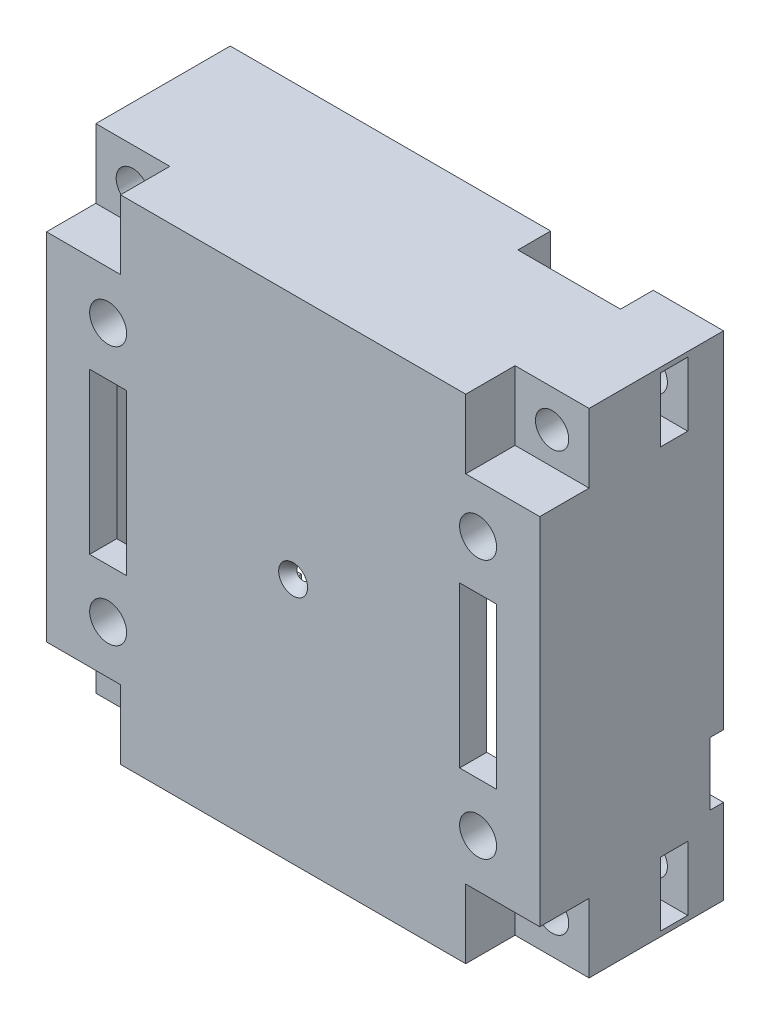
from build123d import *

# Parameters (mm, degrees)
SKETCH_1_W               = 40
SKETCH_1_H               = 40
EXTRUDE_1_DEPTH          = 12.7
CUT_EXTRUDE_2_DEPTH      = 0.7
CUT_EXTRUDE_2_DEPTH_BACK = 1.5
SKETCH_8_W               = 36.4
SKETCH_8_H               = 28.4
CUT_EXTRUDE_4_DEPTH      = 12.7
SKETCH_10_R              = 0.5
SKETCH_10_R_2            = 1.5
SKETCH_10_W              = 3
SKETCH_10_H              = 13
EXTRUDE_2_DEPTH          = 2.2
CUT_EXTRUDE_START        = -12.7
SKETCH_13_R              = 1.35
CUT_EXTRUDE_6_DEPTH      = 12.7
FILLET_1_R               = 1
SKETCH_14_W              = 8.31999735
SKETCH_14_H              = 2.64999918
CUT_EXTRUDE_8_DEPTH      = 5.8
SKETCH_15_W              = 12.8999835
SKETCH_15_H              = 7.3
CUT_EXTRUDE_9_DEPTH      = 5.8
SKETCH_16_W              = 1.085536683
SKETCH_16_H              = 5.100270408
CUT_EXTRUDE_10_DEPTH     = 1.8
SKETCH_17_W              = 8.31999735
SKETCH_17_H              = 2.65925193
CUT_EXTRUDE_11_DEPTH     = 5.8
SKETCH_23_W              = 6.0022214
SKETCH_23_H              = 5.598076211
SKETCH_23_H_2            = 5.598076212
CUT_EXTRUDE_12_DEPTH     = 4
SKETCH_24_W              = 11
SKETCH_24_H              = 14
CUT_EXTRUDE_14_DEPTH     = 1.4


with BuildPart() as part:
    # 草图1 → 凸台-拉伸1 (new body)
    with BuildSketch(Plane(origin=(0, 0, -12.4), x_dir=(-1, 0, 0), z_dir=(0, 0, -1))):
        with Locations((-18.22949197, 11.132690632)):
            Rectangle(SKETCH_1_W, SKETCH_1_H)
    extrude(amount=-EXTRUDE_1_DEPTH)

    # 草图2 → 切除-拉伸2 (cut, two sides: drawn at the far end of the back side and taken through both)
    with BuildSketch(Plane.XY.offset(-8).offset(-CUT_EXTRUDE_2_DEPTH_BACK)):
        Polygon((-2.01828663, -8.469233156), (2.73171337, -8.469233156), (4.23171337, -5.871156945), (2.72949197, -3.269233156), (-2.01828663, -3.269233156), align=None)
        Polygon((-2.01828663, 25.534614421), (-2.01828663, 30.734614421), (2.73171337, 30.734614421), (4.23171337, 28.13653821), (2.72949197, 25.534614421), align=None)
        Polygon((38.47727057, 30.734614421), (33.72727057, 30.734614421), (32.22727057, 28.13653821), (33.72949197, 25.534614421), (38.47727057, 25.534614421), align=None)
        Polygon((38.47727057, -3.269233156), (38.47727057, -8.469233156), (33.72727057, -8.469233156), (32.22727057, -5.871156945), (33.72949197, -3.269233156), align=None)
    extrude(amount=CUT_EXTRUDE_2_DEPTH + CUT_EXTRUDE_2_DEPTH_BACK, mode=Mode.SUBTRACT)

    # 草图8 → 切除-拉伸4 (cut)
    with BuildSketch(Plane(origin=(0, 0, -12.4), x_dir=(-1, 0, 0), z_dir=(0, 0, -1))):
        with Locations((-18.22949197, 11.132690632)):
            Rectangle(SKETCH_8_W, SKETCH_8_H)
    extrude(amount=-CUT_EXTRUDE_4_DEPTH, mode=Mode.SUBTRACT)

    # 草图13 → 切除-拉伸6 (cut)
    with BuildSketch(Plane(origin=(0, 0, -12.4), x_dir=(-1, 0, 0), z_dir=(0, 0, -1)).offset(CUT_EXTRUDE_START)):
        with Locations((-35.22949197, -5.867309368)):
            Circle(SKETCH_13_R)
        with Locations(Location((-1.22949197, -5.867309368, 0), (0, 0, 180))):
            Circle(SKETCH_13_R)
        with Locations((-1.22949197, 28.132690632)):
            Circle(SKETCH_13_R)
        with Locations(Location((-35.22949197, 28.132690632, 0), (0, 0, 180))):
            Circle(SKETCH_13_R)
    extrude(amount=CUT_EXTRUDE_6_DEPTH, mode=Mode.SUBTRACT)

    # 圆角1
    fillet_1_edges = [part.edges().sort_by_distance(p)[0] for p in [
        (0.02949197, 25.332690632, -6.05),
        (0.02949197, -3.067309368, -6.05),
        (36.42949197, -3.067309368, -6.05),
        (36.42949197, 25.332690632, -6.05),
    ]]
    fillet(fillet_1_edges, radius=FILLET_1_R)

    # 草图14 → 切除-拉伸8 (cut)
    with BuildSketch(Plane.XZ.offset(8.867309368)):
        with Locations((8.169941285, -11.07500041)):
            Rectangle(SKETCH_14_W, SKETCH_14_H)
    extrude(amount=-CUT_EXTRUDE_8_DEPTH, mode=Mode.SUBTRACT)

    # 草图15 → 切除-拉伸9 (cut)
    with BuildSketch(Plane.XZ.offset(8.867309368)):
        with Locations((23.79587104, -8.75)):
            Rectangle(SKETCH_15_W, SKETCH_15_H)
    extrude(amount=-CUT_EXTRUDE_9_DEPTH, mode=Mode.SUBTRACT)

    # 草图16 → 切除-拉伸10 (cut)
    with BuildSketch(Plane(origin=(38.22949197, 0, 0), x_dir=(0, 0, -1), z_dir=(1, 0, 0))):
        with Locations((11.857231659, 0.566559812)):
            Rectangle(SKETCH_16_W, SKETCH_16_H)
    extrude(amount=-CUT_EXTRUDE_10_DEPTH, mode=Mode.SUBTRACT)

    # 草图17 → 切除-拉伸11 (cut)
    with BuildSketch(Plane(origin=(0, 31.132690632, 0), x_dir=(1, 0, 0), z_dir=(0, 1, 0))):
        with Locations((28.372981895, 11.070374035)):
            Rectangle(SKETCH_17_W, SKETCH_17_H)
    extrude(amount=-CUT_EXTRUDE_11_DEPTH, mode=Mode.SUBTRACT)

    # 草图23 → 切除-拉伸12 (cut)
    with BuildSketch(Plane.XY.offset(2.5)):
        with Locations((35.22838127, 28.333652527)):
            Rectangle(SKETCH_23_W, SKETCH_23_H)
        with Locations((35.22838127, -6.068271262)):
            Rectangle(SKETCH_23_W, SKETCH_23_H_2)
        with Locations((1.23060267, -6.068271262)):
            Rectangle(SKETCH_23_W, SKETCH_23_H_2)
        with Locations((1.23060267, 28.333652527)):
            Rectangle(SKETCH_23_W, SKETCH_23_H)
    extrude(amount=-CUT_EXTRUDE_12_DEPTH, mode=Mode.SUBTRACT)


with BuildPart() as body_2:
    # 草图10 → 凸台-拉伸2 (new body)
    with BuildSketch(Plane.XY.offset(0.3)):
        Polygon((-1.77050803, 25.534614421), (4.23171337, 25.534614421), (4.23171337, 31.132690632), (32.22727057, 31.132690632), (32.22727057, 25.534614421), (38.22949197, 25.534614421), (38.22949197, -3.269233156), (32.22727057, -3.269233156), (32.22727057, -8.867309368), (4.23171337, -8.867309368), (4.23171337, -3.269233156), (-1.77050803, -3.269233156), align=None)
        with Locations((18.22949197, 11.132690632)):
            Circle(SKETCH_10_R, mode=Mode.SUBTRACT)
        with Locations((3.22949197, 0.632690632)):
            Circle(SKETCH_10_R_2, mode=Mode.SUBTRACT)
        with Locations((3.22949197, 21.632690632)):
            Circle(SKETCH_10_R_2, mode=Mode.SUBTRACT)
        with Locations(Location((33.22949197, 21.632690632, 0), (0, 0, 180))):
            Circle(SKETCH_10_R_2, mode=Mode.SUBTRACT)
        with Locations(Location((33.22949197, 0.632690632, 0), (0, 0, 180))):
            Circle(SKETCH_10_R_2, mode=Mode.SUBTRACT)
        with Locations((3.22949197, 11.132690632)):
            Rectangle(SKETCH_10_W, SKETCH_10_H, mode=Mode.SUBTRACT)
        with Locations((33.22949197, 11.132690632)):
            Rectangle(SKETCH_10_W, SKETCH_10_H, mode=Mode.SUBTRACT)
    extrude(amount=EXTRUDE_2_DEPTH)

    # 草图24 → 切除-拉伸14 (cut)
    with BuildSketch(Plane(origin=(0, 0, 0.3), x_dir=(-1, 0, 0), z_dir=(0, 0, -1))):
        with Locations((-18.22949197, 11.132690632)):
            Rectangle(SKETCH_24_W, SKETCH_24_H)
    extrude(amount=-CUT_EXTRUDE_14_DEPTH, mode=Mode.SUBTRACT)

    # 草图22 → 切除-旋转3 (revolve, cut)
    with BuildSketch(Plane(origin=(0, 11.132690632, 0), x_dir=(-1, 0, 0), z_dir=(0, -1, 0))):
        Polygon((-18.72949197, -1.7), (-19.400771675, -2.5), (-18.22949197, -2.5), (-18.22949197, -1.7), align=None)
    revolve(axis=Axis((18.22949197, 11.132690632, 5.06186702), (0, 0, -1)), mode=Mode.SUBTRACT)

    # Combine 1: union part
    add(part.part)


solid = body_2.part
